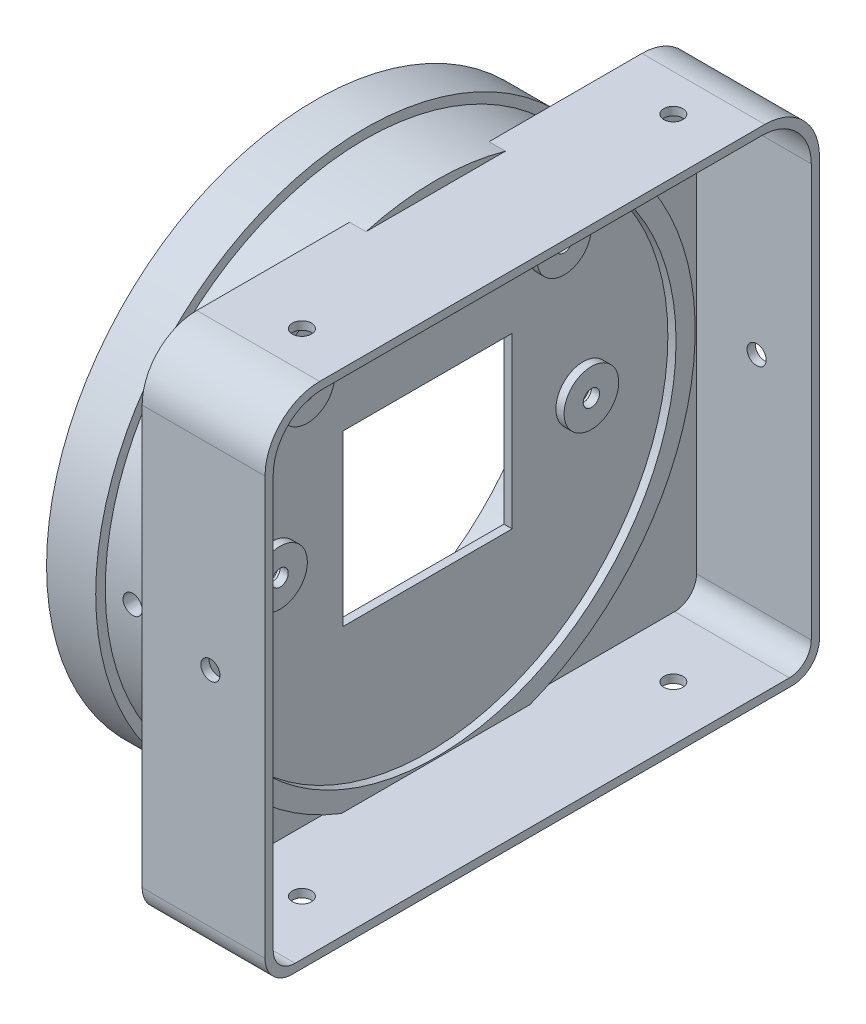
from build123d import *
from build123d.topology import SkipClean

# Parameters (mm, degrees)
SKETCH_1_W          = 101.5
SKETCH_1_H          = 91.5
SKETCH_1_W_2        = 98.5
SKETCH_1_H_2        = 88.5
EXTRUDE_1_DEPTH     = 21
SKETCH_2_W          = 101.5
SKETCH_2_H          = 91.5
SKETCH_2_R          = 1.5
SKETCH_2_W_2        = 31
SKETCH_2_H_2        = 31
EXTRUDE_2_DEPTH     = 1.5
SKETCH_3_R          = 1.75
CUT_EXTRUDE_1_DEPTH = 139.25881527
SKETCH_4_R          = 1.75
CUT_EXTRUDE_2_DEPTH = 139.25881527
FILLET_1_R          = 9
FILLET_2_R          = 10
FILLET_3_R          = 4
FILLET_4_R          = 5
EXTRUDE_START       = -3
SKETCH_5_R          = 47.5
SKETCH_5_R_2        = 1.5
SKETCH_5_W          = 45
SKETCH_5_H          = 46
EXTRUDE_3_DEPTH     = 3
SKETCH_6_R          = 47.5
SKETCH_6_R_2        = 43.5
EXTRUDE_4_DEPTH     = 13
SKETCH_7_R          = 49.25
SKETCH_7_R_2        = 43.5
EXTRUDE_5_DEPTH     = 9
SKETCH_8_R          = 44
SKETCH_8_R_2        = 5
CUT_EXTRUDE_3_DEPTH = 1.5
SKETCH_9_R          = 1.75
CUT_EXTRUDE_4_DEPTH = 141.599608819
SKETCH_10_R         = 3
CUT_EXTRUDE_5_DEPTH = 1.5


with BuildPart() as part:
    # 草图1 → 凸台-拉伸1 (new body)
    with BuildSketch(Plane(origin=(0, 0, 0), x_dir=(0, 0, -1), z_dir=(1, 0, 0))):
        with Locations((50.75, 45.75)):
            Rectangle(SKETCH_1_W, SKETCH_1_H)
        with Locations((50.75, 45.75)):
            Rectangle(SKETCH_1_W_2, SKETCH_1_H_2, mode=Mode.SUBTRACT)
    extrude(amount=EXTRUDE_1_DEPTH)

    # 草图2 → 凸台-拉伸2 (add)
    with BuildSketch(Plane.ZY):
        with Locations((-50.75, 45.75)):
            Rectangle(SKETCH_2_W, SKETCH_2_H)
        with Locations((-27.25, 71.5)):
            Circle(SKETCH_2_R, mode=Mode.SUBTRACT)
        with Locations((-22.25, 44.5)):
            Circle(SKETCH_2_R, mode=Mode.SUBTRACT)
        with Locations(Location((-79.25, 44.5, 0), (0, 0, 180))):
            Circle(SKETCH_2_R, mode=Mode.SUBTRACT)
        with Locations(Location((-74.25, 71.5, 0), (0, 0, 180))):
            Circle(SKETCH_2_R, mode=Mode.SUBTRACT)
        with Locations((-50.75, 45)):
            Rectangle(SKETCH_2_W_2, SKETCH_2_H_2, mode=Mode.SUBTRACT)
    extrude(amount=EXTRUDE_2_DEPTH)

    # 草图3 → 切除-拉伸1 (cut, through all)
    with BuildSketch(Plane.XY):
        with Locations((11, 45.75)):
            Circle(SKETCH_3_R)
    extrude(amount=-CUT_EXTRUDE_1_DEPTH, mode=Mode.SUBTRACT)

    # 草图4 → 切除-拉伸2 (cut, through all)
    with BuildSketch(Plane(origin=(0, 91.5, 0), x_dir=(1, 0, 0), z_dir=(0, 1, 0))):
        with Locations(Location((11, 16.75, 0), (0, 0, 270))):
            Circle(SKETCH_4_R)
        with Locations(Location((11, 84.75, 0), (0, 0, 90))):
            Circle(SKETCH_4_R)
    extrude(amount=-CUT_EXTRUDE_2_DEPTH, mode=Mode.SUBTRACT)

    # 圆角1
    fillet_1_edges = [part.edges().sort_by_distance(p)[0] for p in [
        (10.5, 90, -100),
        (10.5, 90, -1.5),
    ]]
    fillet(fillet_1_edges, radius=FILLET_1_R)

    # 圆角2
    fillet_2_edges = [part.edges().sort_by_distance(p)[0] for p in [
        (9.75, 91.5, 0),
        (9.75, 91.5, -101.5),
    ]]
    fillet(fillet_2_edges, radius=FILLET_2_R)

    # 圆角3
    fillet_3_edges = [part.edges().sort_by_distance(p)[0] for p in [
        (10.5, 1.5, -1.5),
        (10.5, 1.5, -100),
    ]]
    fillet(fillet_3_edges, radius=FILLET_3_R)

    # 圆角4
    fillet_4_edges = [part.edges().sort_by_distance(p)[0] for p in [
        (9.75, 0, -101.5),
        (9.75, 0, 0),
    ]]
    fillet(fillet_4_edges, radius=FILLET_4_R)

    # 草图5 → 凸台-拉伸3 (add)
    with BuildSketch(Plane.ZY.offset(1.5).offset(EXTRUDE_START)):
        with Locations((-50.75, 45.75)):
            Circle(SKETCH_5_R)
        with Locations((-27.25, 71.5)):
            Circle(SKETCH_5_R_2, mode=Mode.SUBTRACT)
        with Locations((-22.25, 44.5)):
            Circle(SKETCH_5_R_2, mode=Mode.SUBTRACT)
        with Locations(Location((-79.25, 44.5, 0), (0, 0, 180))):
            Circle(SKETCH_5_R_2, mode=Mode.SUBTRACT)
        with Locations(Location((-74.25, 71.5, 0), (0, 0, 180))):
            Circle(SKETCH_5_R_2, mode=Mode.SUBTRACT)
        with Locations((-50.75, 43)):
            Rectangle(SKETCH_5_W, SKETCH_5_H, mode=Mode.SUBTRACT)
    extrude(amount=EXTRUDE_3_DEPTH)

    # 草图6 → 凸台-拉伸4 (add)
    with BuildSketch(Plane(origin=(1.5, 0, 0), x_dir=(0, 0, -1), z_dir=(1, 0, 0))):
        with Locations(Location((50.75, 45.75, 0), (0, 0, 105.600995393))):
            Circle(SKETCH_6_R)
        with Locations((50.75, 45.75)):
            Circle(SKETCH_6_R_2, mode=Mode.SUBTRACT)
    extrude(amount=-EXTRUDE_4_DEPTH)

    # 草图7 → 凸台-拉伸5 (add)
    with BuildSketch(Plane.ZY.offset(11.5)):
        with Locations((-50.75, 45.75)):
            Circle(SKETCH_7_R)
        with Locations(Location((-50.75, 45.75, 0), (0, 0, 180))):
            Circle(SKETCH_7_R_2, mode=Mode.SUBTRACT)
    extrude(amount=EXTRUDE_5_DEPTH)

    # 草图8 → 切除-拉伸3 (cut)
    with BuildSketch(Plane(origin=(1.5, 0, 0), x_dir=(0, 0, -1), z_dir=(1, 0, 0))):
        with Locations((50.75, 45.75)):
            Circle(SKETCH_8_R)
        with Locations((74.25, 71.5)):
            Circle(SKETCH_8_R_2, mode=Mode.SUBTRACT)
        with Locations((79.25, 44.5)):
            Circle(SKETCH_8_R_2, mode=Mode.SUBTRACT)
        with Locations((22.25, 44.5)):
            Circle(SKETCH_8_R_2, mode=Mode.SUBTRACT)
        with Locations((27.25, 71.5)):
            Circle(SKETCH_8_R_2, mode=Mode.SUBTRACT)
    extrude(amount=-CUT_EXTRUDE_3_DEPTH, mode=Mode.SUBTRACT)

    # 草图9 → 切除-拉伸4 (cut, through all)
    with SkipClean():  # the faces are left unmerged after this step: merging them gives an invalid solid
        with BuildSketch(Plane.XY):
            with Locations((-6.5, 45.75)):
                Circle(SKETCH_9_R)
        extrude(amount=-CUT_EXTRUDE_4_DEPTH, mode=Mode.SUBTRACT)

    # 草图10 → 切除-拉伸5 (cut)
    with SkipClean():  # the faces are left unmerged after this step: merging them gives an invalid solid
        with BuildSketch(Plane.ZY.offset(1.5)):
            with Locations((-74.25, 71.5)):
                Circle(SKETCH_10_R)
            with Locations((-27.25, 71.5)):
                Circle(SKETCH_10_R)
            with Locations((-22.25, 44.5)):
                Circle(SKETCH_10_R)
            with Locations((-79.25, 44.5)):
                Circle(SKETCH_10_R)
        extrude(amount=-CUT_EXTRUDE_5_DEPTH, mode=Mode.SUBTRACT)


solid = part.part
